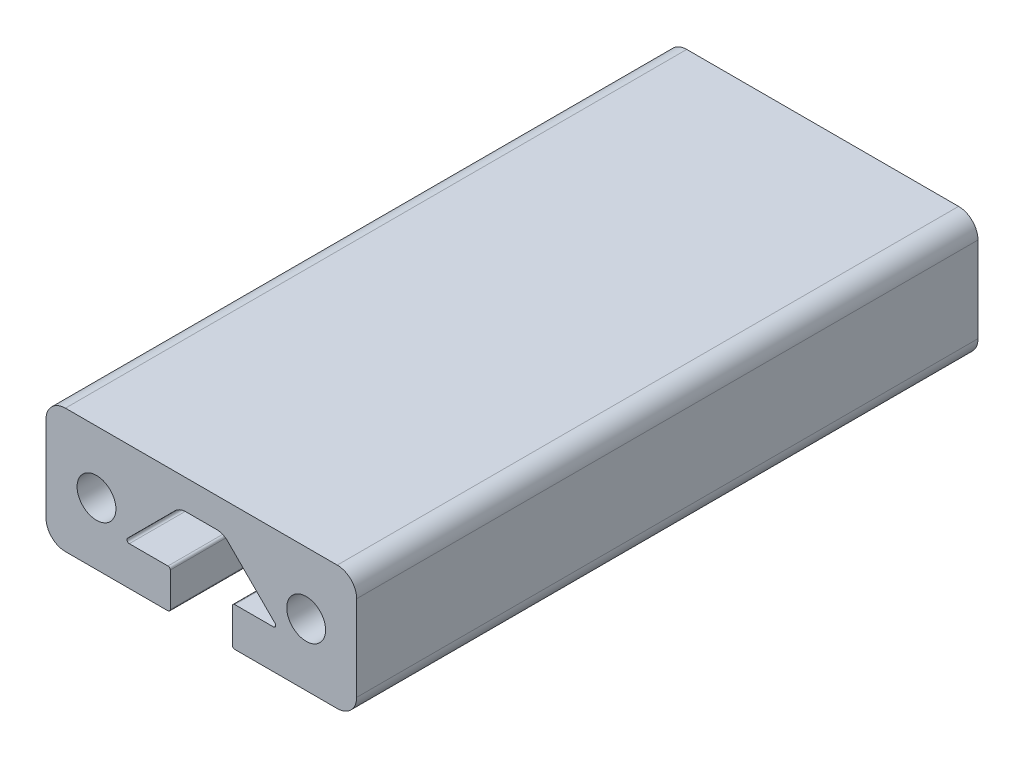
from build123d import *

# Parameters (mm, degrees)
SKETCH_1_R      = 2.5
EXTRUDE_1_DEPTH = 80


with BuildPart() as part:
    # 草图1 → 凸台-拉伸1 (new body)
    with BuildSketch(Plane.XY):
        with BuildLine():
            Line((-2.454380926, 4.654207574), (1.488764825, 4.654207574))
            ThreePointArc((1.488764825, 4.654207574), (2.254131689, 4.501966639), (2.902978387, 4.068421136))
            Line((2.902978387, 4.068421136), (9.005059915, -2.033660392))
            ThreePointArc((9.005059915, -2.033660392), (9.070091741, -2.360597456), (8.792927881, -2.545792426))
            Line((8.792927881, -2.545792426), (3.817191949, -2.545792426))
            ThreePointArc((3.817191949, -2.545792426), (3.605059915, -2.633660392), (3.517191949, -2.845792426))
            Line((3.517191949, -2.845792426), (3.517191949, -7.245792426))
            ThreePointArc((3.517191949, -7.245792426), (3.605059915, -7.457924461), (3.817191949, -7.545792426))
            Line((3.817191949, -7.545792426), (17.017191949, -7.545792426))
            ThreePointArc((17.017191949, -7.545792426), (18.784958902, -6.813559379), (19.517191949, -5.045792426))
            Line((19.517191949, -5.045792426), (19.517191949, 5.954207574))
            ThreePointArc((19.517191949, 5.954207574), (18.784958902, 7.721974527), (17.017191949, 8.454207574))
            Line((17.017191949, 8.454207574), (-17.982808051, 8.454207574))
            ThreePointArc((-17.982808051, 8.454207574), (-19.750575003, 7.721974527), (-20.482808051, 5.954207574))
            Line((-20.482808051, 5.954207574), (-20.482808051, -5.045792426))
            ThreePointArc((-20.482808051, -5.045792426), (-19.750575003, -6.813559379), (-17.982808051, -7.545792426))
            Line((-17.982808051, -7.545792426), (-4.782808051, -7.545792426))
            ThreePointArc((-4.782808051, -7.545792426), (-4.570676016, -7.457924461), (-4.482808051, -7.245792426))
            Line((-4.482808051, -7.245792426), (-4.482808051, -2.845792426))
            ThreePointArc((-4.482808051, -2.845792426), (-4.570676016, -2.633660392), (-4.782808051, -2.545792426))
            Line((-4.782808051, -2.545792426), (-9.758543982, -2.545792426))
            ThreePointArc((-9.758543982, -2.545792426), (-10.035707842, -2.360597456), (-9.970676016, -2.033660392))
            Line((-9.970676016, -2.033660392), (-3.868594488, 4.068421136))
            ThreePointArc((-3.868594488, 4.068421136), (-3.219747791, 4.501966639), (-2.454380926, 4.654207574))
        make_face()
        with Locations((-13.982808051, 0.454207574)):
            Circle(SKETCH_1_R, mode=Mode.SUBTRACT)
        with Locations((13.017191949, 0.454207574)):
            Circle(SKETCH_1_R, mode=Mode.SUBTRACT)
    extrude(amount=EXTRUDE_1_DEPTH)


solid = part.part
